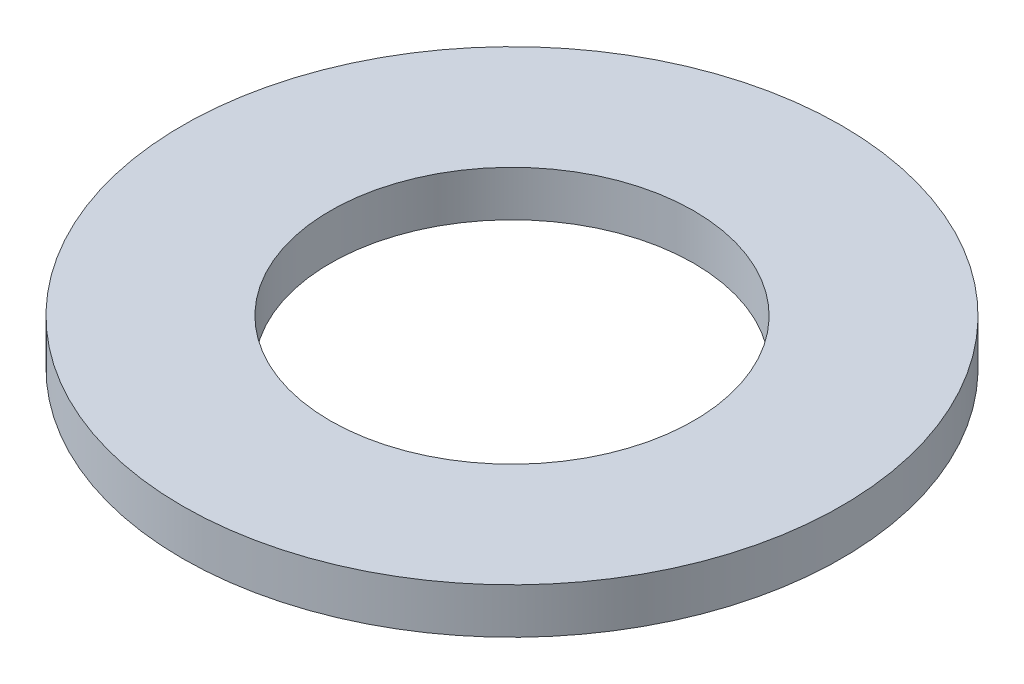
from build123d import *

# Parameters (mm, degrees)
SKETCH1_R           = 14.5
SKETCH1_R_2         = 8
BOSS_EXTRUDE1_DEPTH = 2


with BuildPart() as part:
    # Sketch1 → Boss-Extrude1 (new body)
    with BuildSketch(Plane(origin=(0, 0, 0), x_dir=(1, 0, 0), z_dir=(0, 1, 0))):
        with Locations(Location((0, 0, 0), (0, 0, 270))):
            Circle(SKETCH1_R)
        with Locations(Location((0, 0, 0), (0, 0, 270))):
            Circle(SKETCH1_R_2, mode=Mode.SUBTRACT)
    extrude(amount=BOSS_EXTRUDE1_DEPTH)


solid = part.part
